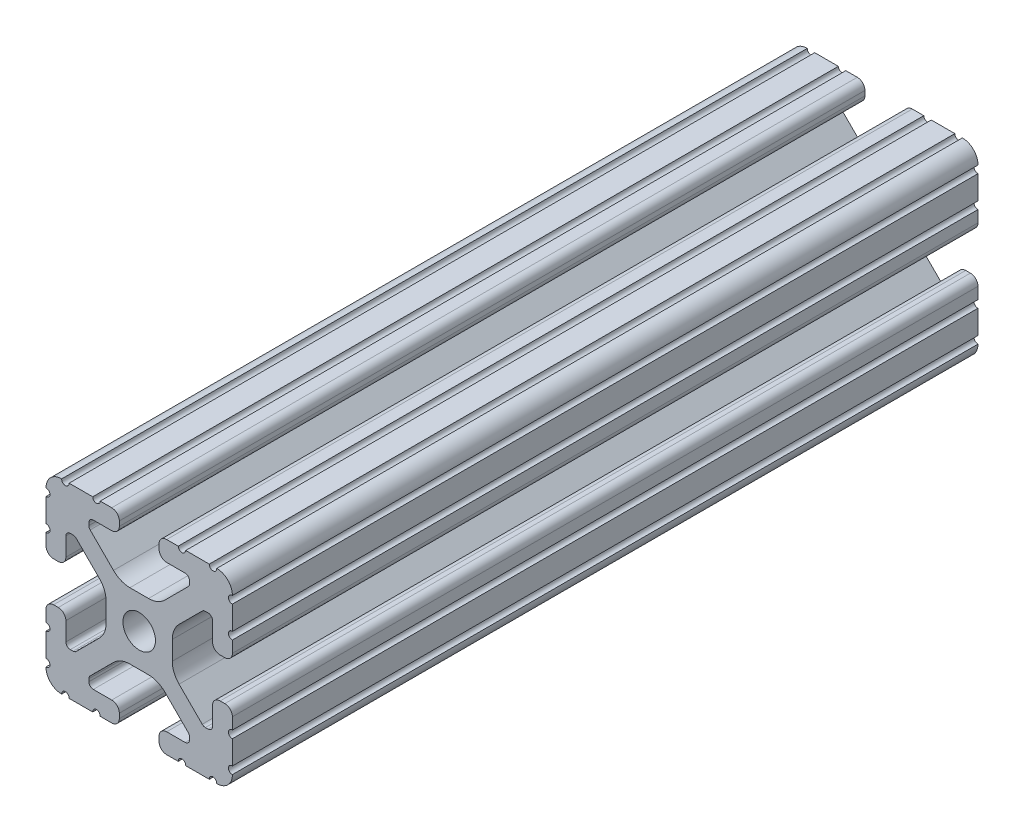
from build123d import *

# Parameters (mm, degrees)
SKETCH1_R = 3.3274


with BuildPart() as part:
    # Sweep4: sweep along a path in Sketch2
    with BuildLine(Plane(origin=(0, 0, 0), x_dir=(1, 0, 0), z_dir=(0, 1, 0))) as sweep4_path:
        Line((0, 152.4), (0, 304.8))
    # Sketch1 → Sweep4 (sweep)
    with BuildSketch(Plane(origin=(0, 0, -304.8), x_dir=(-1, 0, 0), z_dir=(0, 0, -1))):
        with BuildLine():
            Line((14.327719201, 19.050000003), (9.498178698, 19.050000003))
            ThreePointArc((9.498178698, 19.050000003), (8.736178698, 18.288000003), (7.974178698, 19.050000003))
            Line((7.974178698, 19.050000003), (5.61761756, 19.050000003))
            ThreePointArc((5.61761756, 19.050000003), (4.519044055, 18.594955959), (4.06400001, 17.496382454))
            Line((4.06400001, 17.496382454), (4.06400001, 16.539617563))
            ThreePointArc((4.06400001, 16.539617563), (4.519044055, 15.441044058), (5.61761756, 14.986000013))
            Line((5.61761756, 14.986000013), (9.38530001, 14.986000013))
            ThreePointArc((9.38530001, 14.986000013), (10.022898195, 14.721898198), (10.28700001, 14.084300013))
            Line((10.28700001, 14.084300013), (10.28700001, 13.552357144))
            ThreePointArc((10.28700001, 13.552357144), (10.218362397, 13.207292006), (10.022898979, 12.914759744))
            Line((10.022898979, 12.914759744), (5.252158118, 8.144007146))
            ThreePointArc((5.252158118, 8.144007146), (3.715177385, 7.117027402), (1.902183988, 6.756400013))
            Line((1.902183988, 6.756400013), (-1.902183965, 6.756400013))
            ThreePointArc((-1.902183965, 6.756400013), (-3.715177361, 7.117027401), (-5.252158094, 8.144007145))
            Line((-5.252158094, 8.144007145), (-10.022898959, 12.914759744))
            ThreePointArc((-10.022898959, 12.914759744), (-10.218362376, 13.207292006), (-10.28699999, 13.552357144))
            Line((-10.28699999, 13.552357144), (-10.28699999, 14.084300013))
            ThreePointArc((-10.28699999, 14.084300013), (-10.022898174, 14.721898198), (-9.38529999, 14.986000013))
            Line((-9.38529999, 14.986000013), (-5.617617539, 14.986000013))
            ThreePointArc((-5.617617539, 14.986000013), (-4.519044035, 15.441044058), (-4.06399999, 16.539617563))
            Line((-4.06399999, 16.539617563), (-4.06399999, 17.496382454))
            ThreePointArc((-4.06399999, 17.496382454), (-4.519044035, 18.594955959), (-5.617617539, 19.050000003))
            Line((-5.617617539, 19.050000003), (-7.974178709, 19.050000003))
            ThreePointArc((-7.974178709, 19.050000003), (-8.736178709, 18.288000003), (-9.498178709, 19.050000003))
            Line((-9.498178709, 19.050000003), (-14.327719212, 19.050000003))
            ThreePointArc((-14.327719212, 19.050000003), (-15.087603125, 18.231251135), (-15.847487045, 19.049999996))
            ThreePointArc((-15.847487045, 19.049999996), (-18.120176306, 18.120192065), (-19.050000001, 15.847509253))
            ThreePointArc((-19.050000001, 15.847509253), (-18.231251012, 15.087625373), (-19.049999993, 14.327741484))
            Line((-19.049999993, 14.327741484), (-19.049999993, 9.49609147))
            ThreePointArc((-19.049999993, 9.49609147), (-18.231250986, 8.736207564), (-19.049999993, 7.976323658))
            Line((-19.049999993, 7.976323658), (-19.049999993, 5.617617549))
            ThreePointArc((-19.049999993, 5.617617549), (-18.594955948, 4.519044045), (-17.496382444, 4.064))
            Line((-17.496382444, 4.064), (-16.539617542, 4.064))
            ThreePointArc((-16.539617542, 4.064), (-15.441044038, 4.519044045), (-14.985999993, 5.617617549))
            Line((-14.985999993, 5.617617549), (-14.985999993, 9.385342517))
            ThreePointArc((-14.985999993, 9.385342517), (-14.721898178, 10.022940702), (-14.084299993, 10.287042517))
            Line((-14.084299993, 10.287042517), (-13.516042079, 10.287042517))
            ThreePointArc((-13.516042079, 10.287042517), (-13.170975915, 10.218404479), (-12.87844311, 10.022939917))
            Line((-12.87844311, 10.022939917), (-8.147580073, 5.292065242))
            ThreePointArc((-8.147580073, 5.292065242), (-7.117955872, 3.751120652), (-6.756399993, 1.933453584))
            Line((-6.756399993, 1.933453584), (-6.756399993, -1.933453584))
            ThreePointArc((-6.756399993, -1.933453584), (-7.117955872, -3.751120652), (-8.147580073, -5.292065242))
            Line((-8.147580073, -5.292065242), (-12.87844311, -10.022939917))
            ThreePointArc((-12.87844311, -10.022939917), (-13.170975915, -10.218404479), (-13.516042079, -10.287042517))
            Line((-13.516042079, -10.287042517), (-14.084299993, -10.287042517))
            ThreePointArc((-14.084299993, -10.287042517), (-14.721898178, -10.022940702), (-14.985999993, -9.385342517))
            Line((-14.985999993, -9.385342517), (-14.985999993, -5.617617549))
            ThreePointArc((-14.985999993, -5.617617549), (-15.441044038, -4.519044045), (-16.539617542, -4.064))
            Line((-16.539617542, -4.064), (-17.496382444, -4.064))
            ThreePointArc((-17.496382444, -4.064), (-18.594955948, -4.519044045), (-19.049999993, -5.617617549))
            Line((-19.049999993, -5.617617549), (-19.049999993, -7.97631849))
            ThreePointArc((-19.049999993, -7.97631849), (-18.231250986, -8.736202396), (-19.049999993, -9.496086301))
            Line((-19.049999993, -9.496086301), (-19.049999993, -14.327742909))
            ThreePointArc((-19.049999993, -14.327742909), (-18.231250983, -15.08762681), (-19.049999984, -15.847510721))
            ThreePointArc((-19.049999984, -15.847510721), (-18.120175688, -18.120192657), (-15.847486815, -19.049999997))
            ThreePointArc((-15.847486815, -19.049999997), (-15.087602925, -18.231251148), (-14.327719025, -19.049999987))
            Line((-14.327719025, -19.049999987), (-9.496062438, -19.049999987))
            ThreePointArc((-9.496062438, -19.049999987), (-8.736178522, -18.231251122), (-7.976294605, -19.049999987))
            Line((-7.976294605, -19.049999987), (-5.617617539, -19.049999987))
            ThreePointArc((-5.617617539, -19.049999987), (-4.519044035, -18.594955942), (-4.06399999, -17.496382437))
            Line((-4.06399999, -17.496382437), (-4.06399999, -16.539617536))
            ThreePointArc((-4.06399999, -16.539617536), (-4.519044035, -15.441044031), (-5.617617539, -14.985999987))
            Line((-5.617617539, -14.985999987), (-9.38529999, -14.985999987))
            ThreePointArc((-9.38529999, -14.985999987), (-10.022898174, -14.721898171), (-10.28699999, -14.084299987))
            Line((-10.28699999, -14.084299987), (-10.28699999, -13.552357118))
            ThreePointArc((-10.28699999, -13.552357118), (-10.218362376, -13.207291979), (-10.022898959, -12.914759717))
            Line((-10.022898959, -12.914759717), (-5.252158094, -8.144007118))
            ThreePointArc((-5.252158094, -8.144007118), (-3.715177361, -7.117027375), (-1.902183965, -6.756399987))
            Line((-1.902183965, -6.756399987), (1.902183988, -6.756399987))
            ThreePointArc((1.902183988, -6.756399987), (3.715177385, -7.117027375), (5.252158118, -8.144007119))
            Line((5.252158118, -8.144007119), (10.022898979, -12.914759717))
            ThreePointArc((10.022898979, -12.914759717), (10.218362397, -13.207291979), (10.28700001, -13.552357118))
            Line((10.28700001, -13.552357118), (10.28700001, -14.084299987))
            ThreePointArc((10.28700001, -14.084299987), (10.022898195, -14.721898171), (9.38530001, -14.985999987))
            Line((9.38530001, -14.985999987), (5.61761756, -14.985999987))
            ThreePointArc((5.61761756, -14.985999987), (4.519044055, -15.441044031), (4.06400001, -16.539617536))
            Line((4.06400001, -16.539617536), (4.06400001, -17.496382437))
            ThreePointArc((4.06400001, -17.496382437), (4.519044055, -18.594955942), (5.61761756, -19.049999987))
            Line((5.61761756, -19.049999987), (7.976294626, -19.049999987))
            ThreePointArc((7.976294626, -19.049999987), (8.736178543, -18.231251122), (9.496062459, -19.049999987))
            Line((9.496062459, -19.049999987), (14.327719046, -19.049999987))
            ThreePointArc((14.327719046, -19.049999987), (15.087602959, -18.231251119), (15.847486878, -19.04999998))
            ThreePointArc((15.847486878, -19.04999998), (18.12017574, -18.120192611), (19.050000007, -15.847510662))
            ThreePointArc((19.050000007, -15.847510662), (18.231250911, -15.087626785), (19.050000007, -14.327742909))
            Line((19.050000007, -14.327742909), (19.050000007, -9.496086301))
            ThreePointArc((19.050000007, -9.496086301), (18.231251003, -8.736202395), (19.050000007, -7.976318489))
            Line((19.050000007, -7.976318489), (19.050000007, -5.617617549))
            ThreePointArc((19.050000007, -5.617617549), (18.594955962, -4.519044045), (17.496382458, -4.064))
            Line((17.496382458, -4.064), (16.539617556, -4.064))
            ThreePointArc((16.539617556, -4.064), (15.441044052, -4.519044045), (14.986000007, -5.617617549))
            Line((14.986000007, -5.617617549), (14.986000007, -9.385342517))
            ThreePointArc((14.986000007, -9.385342517), (14.721898191, -10.022940702), (14.084300007, -10.287042517))
            Line((14.084300007, -10.287042517), (13.516042095, -10.287042517))
            ThreePointArc((13.516042095, -10.287042517), (13.170975932, -10.218404479), (12.878443126, -10.022939918))
            Line((12.878443126, -10.022939918), (8.147580087, -5.292065243))
            ThreePointArc((8.147580087, -5.292065243), (7.117955886, -3.751120653), (6.756400007, -1.933453584))
            Line((6.756400007, -1.933453584), (6.756400007, 1.933453584))
            ThreePointArc((6.756400007, 1.933453584), (7.117955886, 3.751120653), (8.147580087, 5.292065243))
            Line((8.147580087, 5.292065243), (12.878443126, 10.022939918))
            ThreePointArc((12.878443126, 10.022939918), (13.170975932, 10.218404479), (13.516042095, 10.287042517))
            Line((13.516042095, 10.287042517), (14.084300007, 10.287042517))
            ThreePointArc((14.084300007, 10.287042517), (14.721898191, 10.022940702), (14.986000007, 9.385342517))
            Line((14.986000007, 9.385342517), (14.986000007, 5.617617549))
            ThreePointArc((14.986000007, 5.617617549), (15.441044052, 4.519044045), (16.539617556, 4.064))
            Line((16.539617556, 4.064), (17.496382458, 4.064))
            ThreePointArc((17.496382458, 4.064), (18.594955962, 4.519044045), (19.050000007, 5.617617549))
            Line((19.050000007, 5.617617549), (19.050000007, 7.976323659))
            ThreePointArc((19.050000007, 7.976323659), (18.231251003, 8.736207565), (19.050000007, 9.496091471))
            Line((19.050000007, 9.496091471), (19.050000007, 14.327741484))
            ThreePointArc((19.050000007, 14.327741484), (18.231251061, 15.087625385), (19.049999988, 15.847509306))
            ThreePointArc((19.049999988, 15.847509306), (18.120176278, 18.120192088), (15.847487034, 19.050000003))
            ThreePointArc((15.847487034, 19.050000003), (15.087603117, 18.231251142), (14.327719201, 19.050000003))
        make_face()
        Circle(SKETCH1_R, mode=Mode.SUBTRACT)
    sweep(path=sweep4_path.line)


solid = part.part
